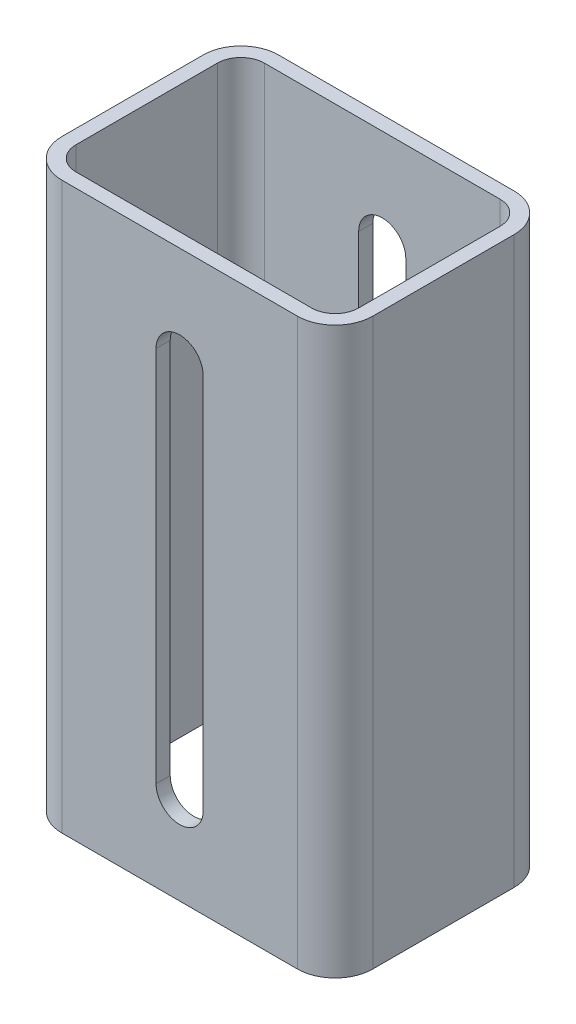
from build123d import *

# Parameters (mm, degrees)
EXTRUDE_THIN1_DEPTH     = 60
CUT_EXTRUDE1_DEPTH      = 83.492423895
CUT_EXTRUDE1_DEPTH_BACK = 83.492423895


with BuildPart() as part:
    # Sketch1 → Extrude-Thin1 (new, symmetric)
    with BuildSketch(Plane(origin=(0, 0, 0), x_dir=(1, 0, 0), z_dir=(0, 1, 0))):
        with BuildLine():
            Line((25, -23), (-25, -23))
            ThreePointArc((-25, -23), (-30.656854249, -20.656854249), (-33, -15))
            Line((-33, -15), (-33, 15))
            ThreePointArc((-33, 15), (-30.656854249, 20.656854249), (-25, 23))
            Line((-25, 23), (25, 23))
            ThreePointArc((25, 23), (30.656854249, 20.656854249), (33, 15))
            Line((33, 15), (33, -15))
            ThreePointArc((33, -15), (30.656854249, -20.656854249), (25, -23))
        make_face()
        with BuildLine():
            Line((25, -20), (-25, -20))
            ThreePointArc((-25, -20), (-28.535533906, -18.535533906), (-30, -15))
            Line((-30, -15), (-30, 15))
            ThreePointArc((-30, 15), (-28.535533906, 18.535533906), (-25, 20))
            Line((-25, 20), (25, 20))
            ThreePointArc((25, 20), (28.535533906, 18.535533906), (30, 15))
            Line((30, 15), (30, -15))
            ThreePointArc((30, -15), (28.535533906, -18.535533906), (25, -20))
        make_face(mode=Mode.SUBTRACT)
    extrude(amount=EXTRUDE_THIN1_DEPTH, both=True)

    # Sketch3 → Cut-Extrude1 (cut, two sides: drawn at the far end of the back side and taken through both)
    with BuildSketch(Plane(origin=(0, 0, -23), x_dir=(-1, 0, 0), z_dir=(0, 0, -1)).offset(-CUT_EXTRUDE1_DEPTH_BACK)):
        with BuildLine():
            Line((-5, -40.937612565), (-5, 39.062387435))
            ThreePointArc((-5, 39.062387435), (0, 44.062387435), (5, 39.062387435))
            Line((5, 39.062387435), (5, -40.937612565))
            ThreePointArc((5, -40.937612565), (0, -45.937612565), (-5, -40.937612565))
        make_face()
    extrude(amount=CUT_EXTRUDE1_DEPTH + CUT_EXTRUDE1_DEPTH_BACK, mode=Mode.SUBTRACT)


solid = part.part
